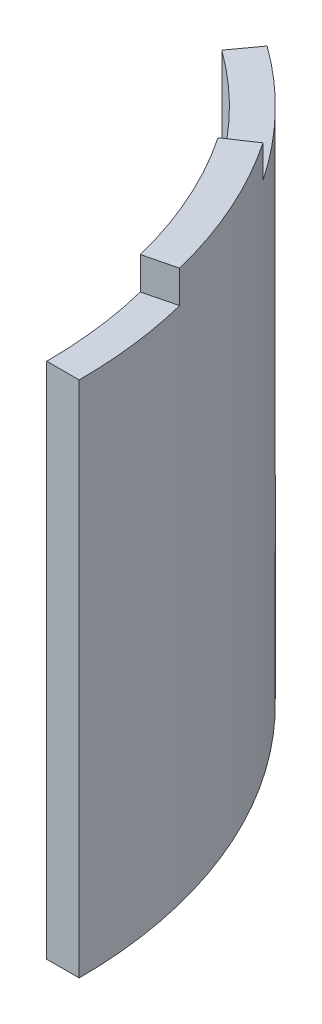
from build123d import *

# Parameters (mm, degrees)
BOSS_EXTRUDE1_DEPTH = 25.3500001
BOSS_EXTRUDE2_START = 3.175
BOSS_EXTRUDE2_DEPTH = 3.175


with BuildPart() as part:
    # Sketch1 → Boss-Extrude1 (new, symmetric)
    with BuildSketch(Plane(origin=(0, 0, 0), x_dir=(1, 0, 0), z_dir=(0, 1, 0))):
        with BuildLine():
            Line((25.380567194, 34.933353817), (27.24678537, 37.501982774))
            ThreePointArc((27.24678537, 37.501982774), (41.302607429, 21.044729615), (46.355, 0))
            Line((46.355, 0), (43.18, 0))
            ThreePointArc((43.18, 0), (38.473661714, 19.603309779), (25.380567194, 34.933353817))
        make_face()
    extrude(amount=BOSS_EXTRUDE1_DEPTH, both=True)

    # Sketch2 → Boss-Extrude2 (add)
    with BuildSketch(Plane(origin=(0, 25.3500001, 0), x_dir=(1, 0, 0), z_dir=(0, 1, 0)).offset(BOSS_EXTRUDE2_START)):
        with BuildLine():
            Line((35.797842383, 24.145949572), (38.430036676, 25.92138704))
            ThreePointArc((38.430036676, 25.92138704), (42.347399689, 18.85427709), (44.978058392, 11.214289471))
            Line((44.978058392, 11.214289471), (41.897369461, 10.446187452))
            ThreePointArc((41.897369461, 10.446187452), (39.446892861, 17.562888248), (35.797842383, 24.145949572))
        make_face()
    extrude(amount=-BOSS_EXTRUDE2_DEPTH)


solid = part.part
